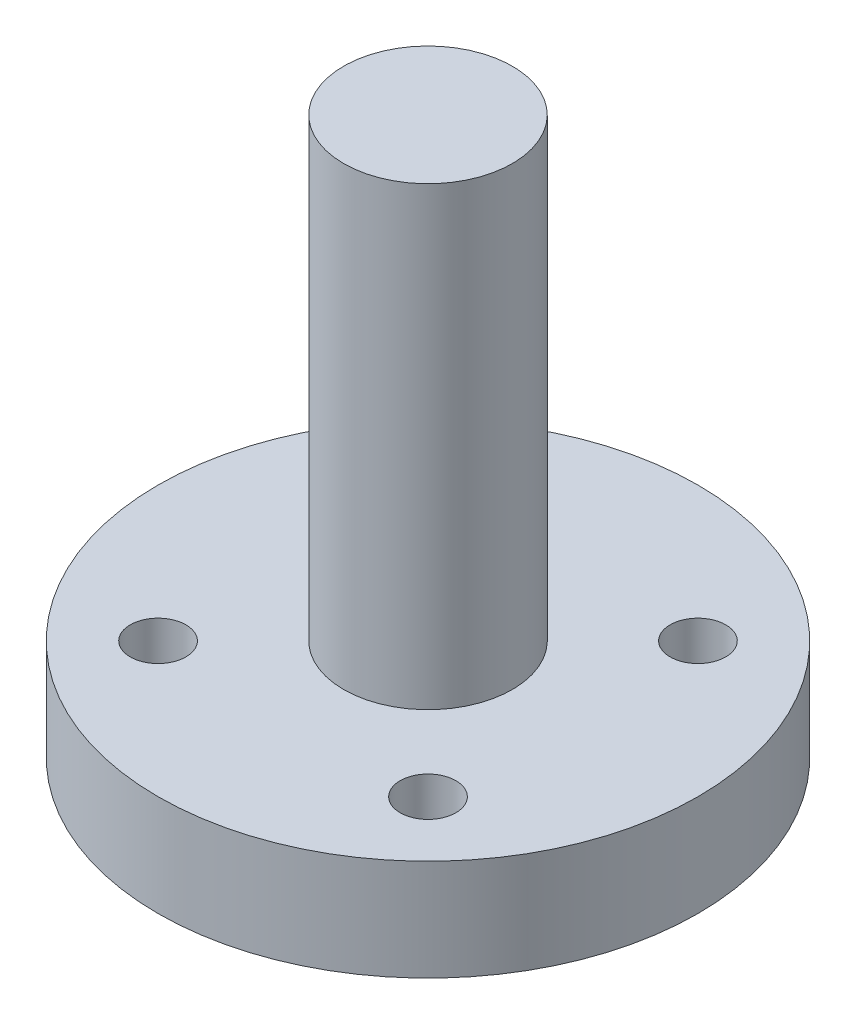
from build123d import *

# Parameters (mm, degrees)
SKETCH1_R                   = 16
BOSS_EXTRUDE1_DEPTH         = 6
TAP_DRILL_FOR_M4X0_7_TAP1_D = 3.3
SKETCH3_R                   = 5
BOSS_EXTRUDE2_DEPTH         = 27


with BuildPart() as part:
    # Sketch1 → Boss-Extrude1 (new body)
    with BuildSketch(Plane(origin=(0, 0, 0), x_dir=(1, 0, 0), z_dir=(0, 1, 0))):
        with Locations(Location((0, 0, 0), (0, 0, 270))):
            Circle(SKETCH1_R)
    extrude(amount=BOSS_EXTRUDE1_DEPTH)

    # Tap Drill for M4x0.7 Tap1 (through all)
    with Locations(Plane(origin=(0, 0, 0), x_dir=(-1, 0, 0), z_dir=(0, -1, 0))):
        with Locations((-8, 8), (-8, -8), (8, -8), (8, 8)):
            Hole(TAP_DRILL_FOR_M4X0_7_TAP1_D / 2)

    # Sketch3 → Boss-Extrude2 (add)
    with BuildSketch(Plane(origin=(0, 6, 0), x_dir=(1, 0, 0), z_dir=(0, 1, 0))):
        with Locations(Location((0, 0, 0), (0, 0, 270))):
            Circle(SKETCH3_R)
    extrude(amount=BOSS_EXTRUDE2_DEPTH)


solid = part.part
